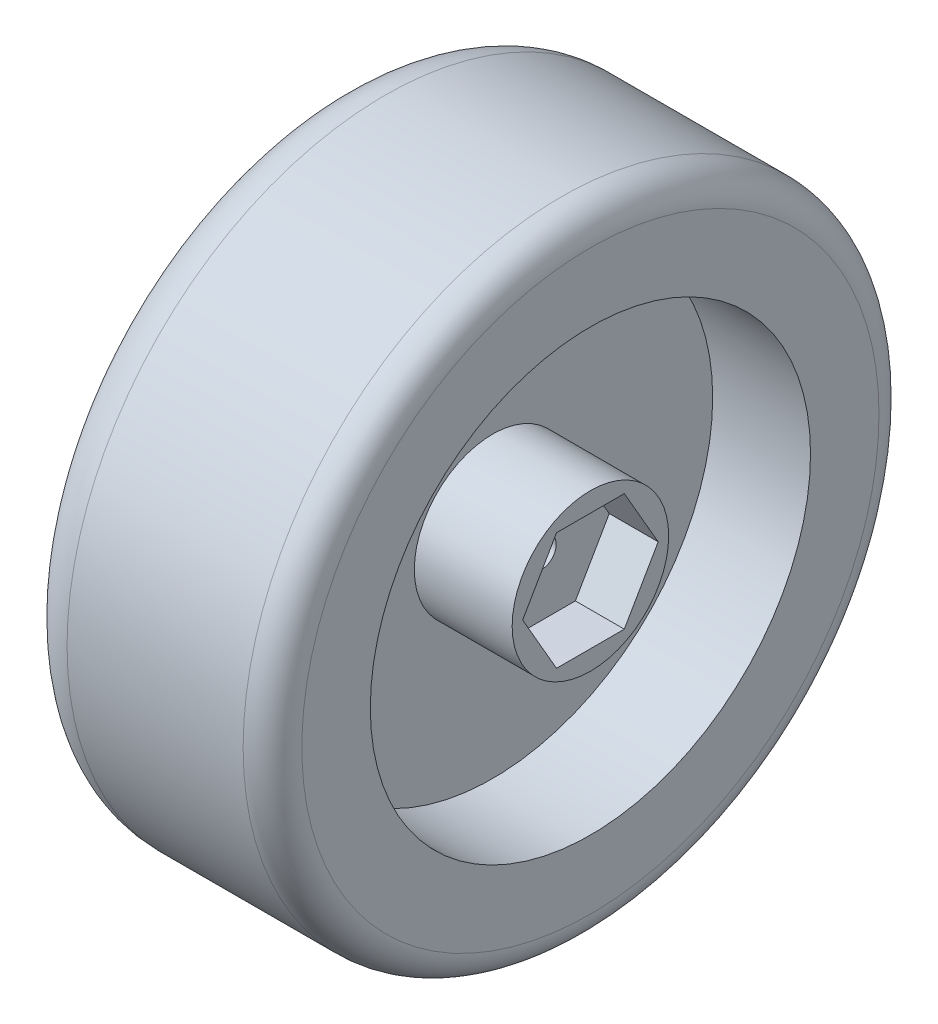
from build123d import *

# Parameters (mm, degrees)
SKETCH_1_W              = 26
SKETCH_1_H              = 32.5
HOLE_WIZARD_M39_1_D     = 45
HOLE_WIZARD_M39_1_DEPTH = 10
SKETCH_4_R              = 8
EXTRUDE_1_DEPTH         = 10
CUT_EXTRUDE_1_DEPTH     = 5
SKETCH_6_R              = 1.5
CUT_EXTRUDE_2_DEPTH     = 53.80624963
FILLET_1_R              = 5
FILLET_2_R              = 3


with BuildPart() as part:
    # 草图1 → 旋转1 (revolve)
    with BuildSketch(Plane(origin=(0, 0, 0), x_dir=(-1, 0, 0), z_dir=(0, 0, -1)), mode=Mode.PRIVATE) as revolve_1_sk:
        with Locations((-13, 16.25)):
            Rectangle(SKETCH_1_W, SKETCH_1_H)
    revolve(revolve_1_sk.sketch.rotate(Axis((26, 0, 0), (-1, 0, 0)), 270), axis=Axis((26, 0, 0), (-1, 0, 0)))

    # M39 间隙孔1
    with Locations(Plane(origin=(26, 0, 0), x_dir=(0, 0, -1), z_dir=(1, 0, 0))):
        with Locations((0, 0)):
            Hole(HOLE_WIZARD_M39_1_D / 2, depth=HOLE_WIZARD_M39_1_DEPTH)

    # 草图4 → 凸台-拉伸1 (add)
    with BuildSketch(Plane(origin=(16, 0, 0), x_dir=(0, 0, -1), z_dir=(1, 0, 0))):
        with Locations(Location((0, 0, 0), (0, 0, 180))):
            Circle(SKETCH_4_R)
    extrude(amount=EXTRUDE_1_DEPTH)

    # 草图5 → 切除-拉伸1 (cut)
    with BuildSketch(Plane(origin=(26, 0, 0), x_dir=(0, 0, -1), z_dir=(1, 0, 0))):
        Polygon((3.464101615, -6), (6.92820323, 0), (3.464101615, 6), (-3.464101615, 6), (-6.92820323, 0), (-3.464101615, -6), align=None)
    extrude(amount=-CUT_EXTRUDE_1_DEPTH, mode=Mode.SUBTRACT)

    # 草图6 → 切除-拉伸2 (cut, through all)
    with BuildSketch(Plane(origin=(0, 0, 0), x_dir=(0, 0, -1), z_dir=(1, 0, 0))):
        Circle(SKETCH_6_R)
    extrude(amount=CUT_EXTRUDE_2_DEPTH, mode=Mode.SUBTRACT)

    # 圆角1
    fillet_1_edges = [part.edges().sort_by_distance(p)[0] for p in [
        (0, 0, -32.5),
    ]]
    fillet(fillet_1_edges, radius=FILLET_1_R)

    # 圆角2
    fillet_2_edges = [part.edges().sort_by_distance(p)[0] for p in [
        (26, 0, -32.5),
    ]]
    fillet(fillet_2_edges, radius=FILLET_2_R)


solid = part.part
